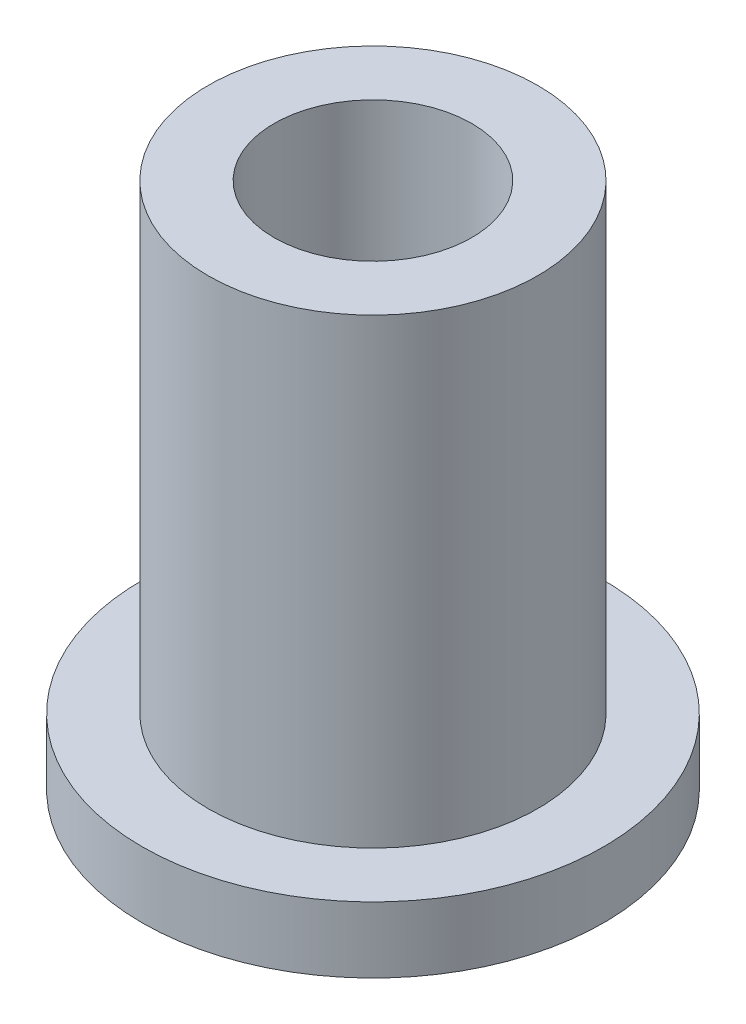
from build123d import *

# Parameters (mm, degrees)
SKETCH1_R           = 5.55625
SKETCH1_R_2         = 2.38125
BOSS_EXTRUDE1_DEPTH = 1.5875
SKETCH2_R           = 3.96875
SKETCH2_R_2         = 2.38125
BOSS_EXTRUDE2_DEPTH = 11.1125


with BuildPart() as part:
    # Sketch1 → Boss-Extrude1 (new body)
    with BuildSketch(Plane(origin=(0, 0, 0), x_dir=(1, 0, 0), z_dir=(0, 1, 0))):
        with Locations(Location((0, 0, 0), (0, 0, 270))):
            Circle(SKETCH1_R)
        with Locations(Location((0, 0, 0), (0, 0, 270))):
            Circle(SKETCH1_R_2, mode=Mode.SUBTRACT)
    extrude(amount=BOSS_EXTRUDE1_DEPTH)

    # Sketch2 → Boss-Extrude2 (add)
    with BuildSketch(Plane(origin=(0, 1.5875, 0), x_dir=(1, 0, 0), z_dir=(0, 1, 0))):
        with Locations(Location((0, 0, 0), (0, 0, 270))):
            Circle(SKETCH2_R)
        with Locations(Location((0, 0, 0), (0, 0, 270))):
            Circle(SKETCH2_R_2, mode=Mode.SUBTRACT)
    extrude(amount=BOSS_EXTRUDE2_DEPTH)


solid = part.part
